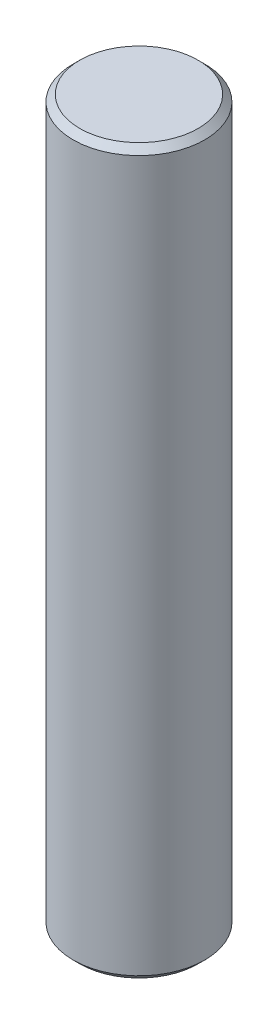
from build123d import *

# Parameters (mm, degrees)
SKETCH_1_R      = 5
EXTRUDE_1_DEPTH = 27.5
CHAMFER_1_SIZE  = 0.5


with BuildPart() as part:
    # 草图1 → 凸台-拉伸1 (new, symmetric)
    with BuildSketch(Plane(origin=(0, 0, 0), x_dir=(1, 0, 0), z_dir=(0, 1, 0))):
        with Locations(Location((0, 0, 0), (0, 0, 270))):
            Circle(SKETCH_1_R)
    extrude(amount=EXTRUDE_1_DEPTH, both=True)

    # 倒角1
    chamfer_1_edges = [part.edges().sort_by_distance(p)[0] for p in [
        (0, -27.5, -5),
        (0, 27.5, -5),
    ]]
    chamfer(chamfer_1_edges, length=CHAMFER_1_SIZE)


solid = part.part
